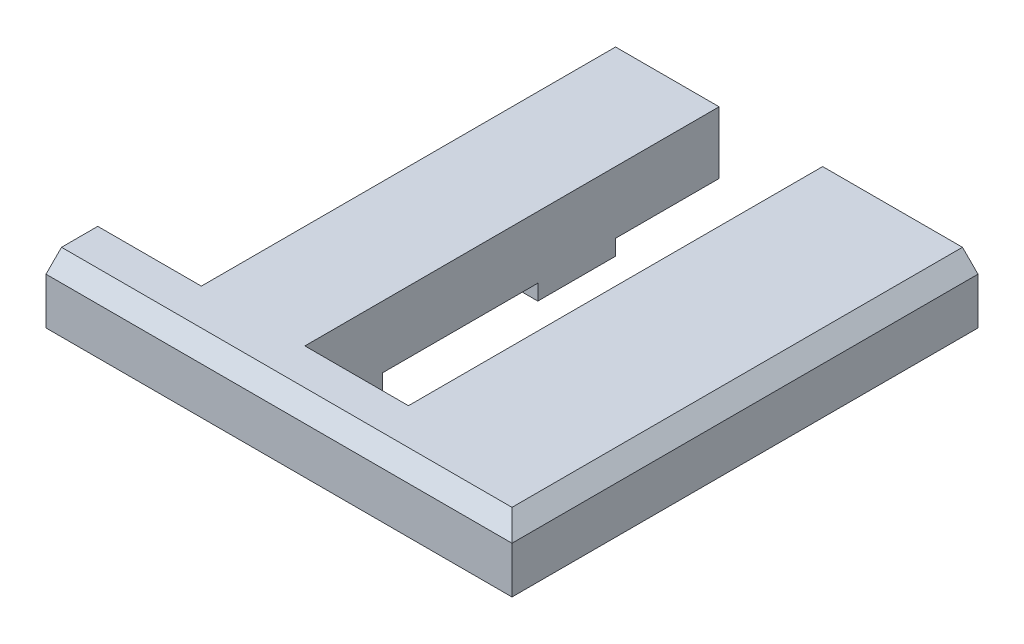
from build123d import *

# Parameters (mm, degrees)
SKETCH1_W           = 50.8
SKETCH1_H           = 203.2
BOSS_EXTRUDE1_DEPTH = 38.1
SKETCH3_R           = 9.525
CUT_EXTRUDE1_DEPTH  = 38.1
SKETCH4_R           = 9.525
CUT_EXTRUDE2_DEPTH  = 38.1
CUT_EXTRUDE3_DEPTH  = 7.62
SKETCH6_W           = 127
SKETCH6_H           = 76.2
CUT_EXTRUDE4_DEPTH  = 7.62
CHAMFER1_SIZE       = 7.62


with BuildPart() as part:
    # Sketch1 → Boss-Extrude1 (new body)
    with BuildSketch(Plane(origin=(0, 0, 0), x_dir=(1, 0, 0), z_dir=(0, 1, 0))):
        Polygon((-25.4, 228.6), (-25.4, 25.4), (-76.2, 25.4), (-127, 25.4), (-177.8, 25.4), (-228.6, 25.4), (-228.6, 0), (0, 0), (0, 228.6), align=None)
        with Locations((-50.8, 127)):
            Rectangle(SKETCH1_W, SKETCH1_H)
        with Locations((-152.4, 127)):
            Rectangle(SKETCH1_W, SKETCH1_H)
    extrude(amount=BOSS_EXTRUDE1_DEPTH)

    # Sketch3 → Cut-Extrude1 (cut)
    with BuildSketch(Plane.ZY.offset(228.6)):
        with Locations((-12.7, 19.05)):
            Circle(SKETCH3_R)
    extrude(amount=-CUT_EXTRUDE1_DEPTH, mode=Mode.SUBTRACT)

    # Sketch4 → Cut-Extrude2 (cut)
    with BuildSketch(Plane(origin=(0, 0, -228.6), x_dir=(-1, 0, 0), z_dir=(0, 0, -1))):
        with Locations((12.684892179, 19.05)):
            Circle(SKETCH4_R)
    extrude(amount=-CUT_EXTRUDE2_DEPTH, mode=Mode.SUBTRACT)

    # Sketch5 → Cut-Extrude3 (cut)
    with BuildSketch(Plane(origin=(0, 0, 0), x_dir=(-1, 0, 0), z_dir=(0, -1, 0))):
        Polygon((50.8, 431.742057994), (50.8, 177.742057994), (279.4, 177.742057994), (279.4, 431.771028997), align=None)
    extrude(amount=-CUT_EXTRUDE3_DEPTH, mode=Mode.SUBTRACT)

    # Sketch6 → Cut-Extrude4 (cut)
    with BuildSketch(Plane(origin=(0, 0, 0), x_dir=(-1, 0, 0), z_dir=(0, -1, 0))):
        with Locations((114.3, 101.571028997)):
            Rectangle(SKETCH6_W, SKETCH6_H)
    extrude(amount=-CUT_EXTRUDE4_DEPTH, mode=Mode.SUBTRACT)

    # Chamfer1
    chamfer1_edges = [part.edges().sort_by_distance(p)[0] for p in [
        (0, 0, -114.3),
        (-114.3, 0, 0),
        (-114.3, 38.1, 0),
        (0, 38.1, -114.3),
    ]]
    chamfer(chamfer1_edges, length=CHAMFER1_SIZE)


solid = part.part
